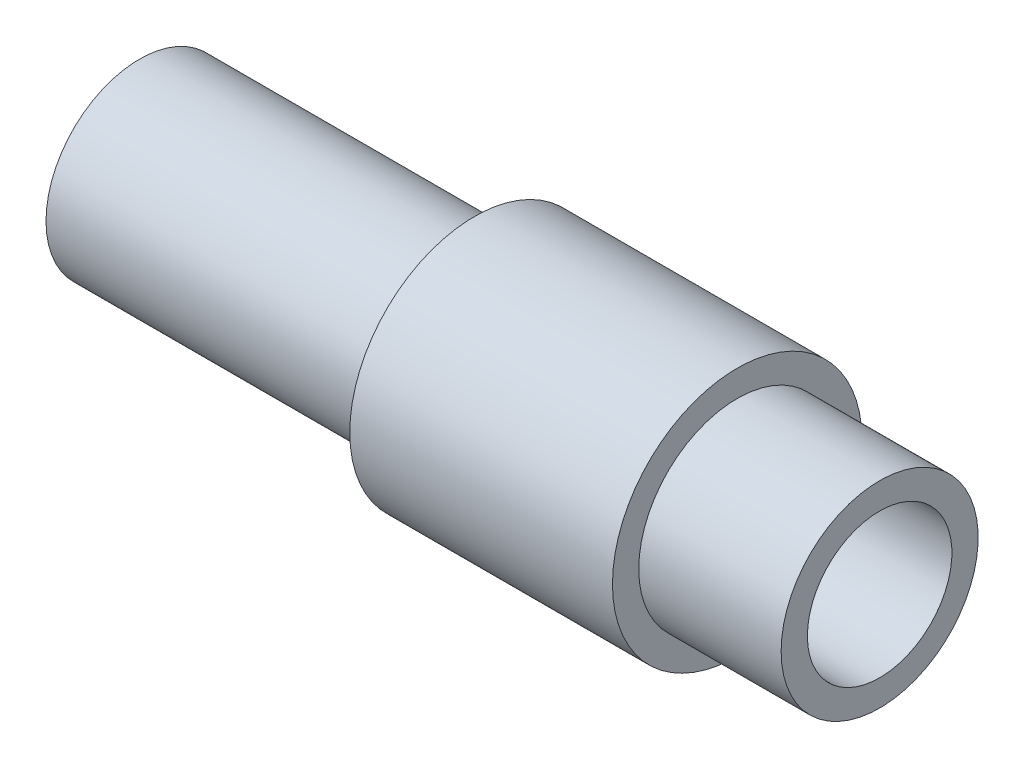
from build123d import *


with BuildPart() as part:
    # Sketch1 → Revolve1 (revolve)
    with BuildSketch(Plane.XY, mode=Mode.PRIVATE) as revolve1_sk:
        Polygon((-72.14273222, 24.757857647), (-44.64273222, 24.757857647), (-44.64273222, 27.132857647), (-28.64273222, 27.132857647), (-28.64273222, 25.132857647), (-15.803496151, 25.132857647), (-15.803496151, 27.132857647), (-26.64273222, 27.132857647), (-26.64273222, 29.132857647), (-46.64273222, 29.132857647), (-46.64273222, 26.757857647), (-72.14273222, 26.757857647), align=None)
    revolve(revolve1_sk.sketch.rotate(Axis((-83.673742698, 19.632857647, 0), (1, 0, 0)), 90), axis=Axis((-83.673742698, 19.632857647, 0), (1, 0, 0)))


solid = part.part
